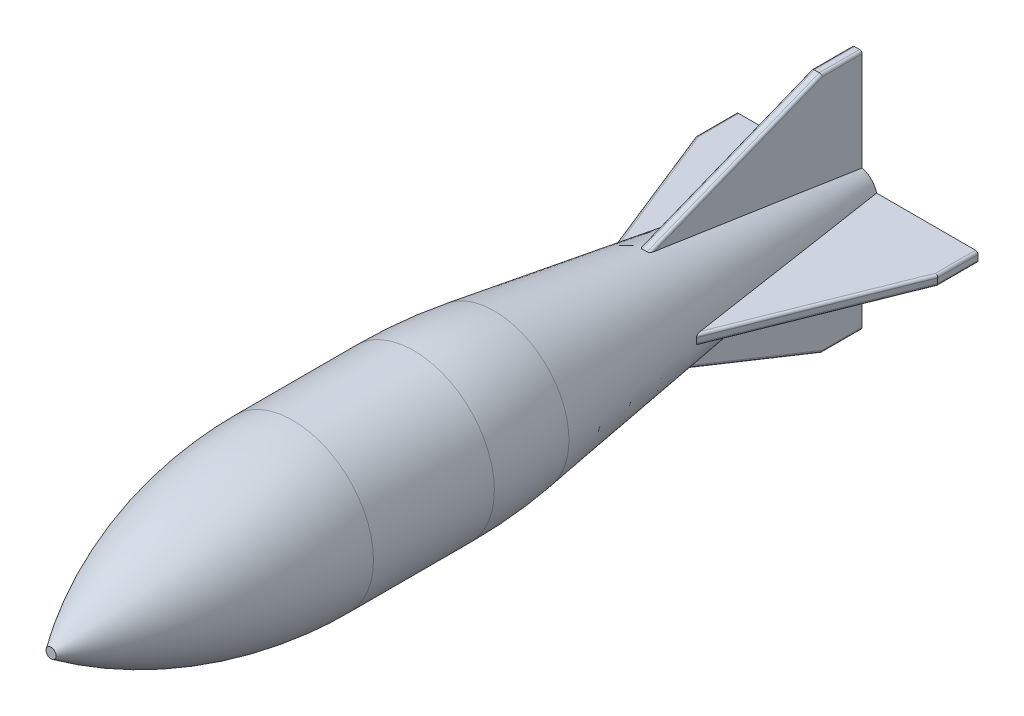
from build123d import *

# Parameters (mm, degrees)
BOSS_EXTRUDE2_DEPTH      = 0.79375
FILLET2_R                = 0.396875
CIRPATTERN5_COUNT        = 4
FILLET2_OF_CIRPATTERN5_R = 0.396875


with BuildPart() as part:
    # Sketch3 → Revolve2 (revolve)
    with BuildSketch(Plane(origin=(0, 0, 0), x_dir=(0, 0, -1), z_dir=(1, 0, 0)), mode=Mode.PRIVATE) as revolve2_sk:
        Polygon((95.444755644, 3.96875), (95.444755644, 0), (127, 0), (127, 3.175), (95.444755644, 7.91092396), align=None)
        with BuildLine():
            Line((0, 0.79375), (0, 0))
            Line((0, 0), (12.894755644, 0))
            ThreePointArc((12.894755644, 0), (15.684563553, 6.735192091), (22.419755644, 9.525))
            Line((22.419755644, 9.525), (79.056444567, 9.525))
            ThreePointArc((79.056444567, 9.525), (82.84913995, 8.715283085), (85.98050057, 6.427323204))
            ThreePointArc((85.98050057, 6.427323204), (88.46580805, 4.611408496), (91.476005644, 3.96875))
            Line((91.476005644, 3.96875), (95.444755644, 3.96875))
            Line((95.444755644, 3.96875), (95.444755644, 7.91092396))
            Line((95.444755644, 7.91092396), (69.85, 11.752276451))
            ThreePointArc((69.85, 11.752276451), (63.517656161, 12.462740177), (57.15, 12.7))
            Line((57.15, 12.7), (38.1, 12.7))
            ThreePointArc((38.1, 12.7), (18.1414881, 9.65411308), (0, 0.79375))
        make_face()
    revolve(revolve2_sk.sketch.rotate(Axis((0, 0, 0), (0, 0, -1)), 90), axis=Axis((0, 0, 0), (0, 0, -1)))

    # Sketch5 → Boss-Extrude2 (add, symmetric)
    with BuildSketch(Plane(origin=(0, 0, 0), x_dir=(0, 0, -1), z_dir=(1, 0, 0))):
        Polygon((120.65, 19.05), (127, 19.05), (127, 0), (88.9, 6.35), align=None)
    boss_extrude2 = extrude(amount=BOSS_EXTRUDE2_DEPTH, both=True)

    # Fillet2
    fillet2_edges = [part.edges().sort_by_distance(p)[0] for p in [
        (-0.79375, 19.05, -123.825),
        (0.79375, 19.05, -123.825),
        (-0.79375, 13.61067, -107.051675),
        (0.79375, 13.61067, -107.051675),
    ]]
    fillet(fillet2_edges, radius=FILLET2_R)

    # CirPattern5: Boss-Extrude2 ×4 about axis
    cirpattern5_axis = Axis((0, 0, 0), (0, 0, 1))
    for i in range(1, CIRPATTERN5_COUNT):
        add(boss_extrude2.rotate(cirpattern5_axis, i * 360 / CIRPATTERN5_COUNT))

    # Fillet2 of CirPattern5
    fillet2_of_cirpattern5_edges = [part.edges().sort_by_distance(p)[0] for p in [
        (-19.05, -0.79375, -123.825),
        (-19.05, 0.79375, -123.825),
        (-13.61067, -0.79375, -107.051675),
        (-13.61067, 0.79375, -107.051675),
        (0.79375, -19.05, -123.825),
        (-0.79375, -19.05, -123.825),
        (0.79375, -13.61067, -107.051675),
        (-0.79375, -13.61067, -107.051675),
        (19.05, 0.79375, -123.825),
        (19.05, -0.79375, -123.825),
        (13.61067, 0.79375, -107.051675),
        (13.61067, -0.79375, -107.051675),
    ]]
    fillet(fillet2_of_cirpattern5_edges, radius=FILLET2_OF_CIRPATTERN5_R)


solid = part.part
